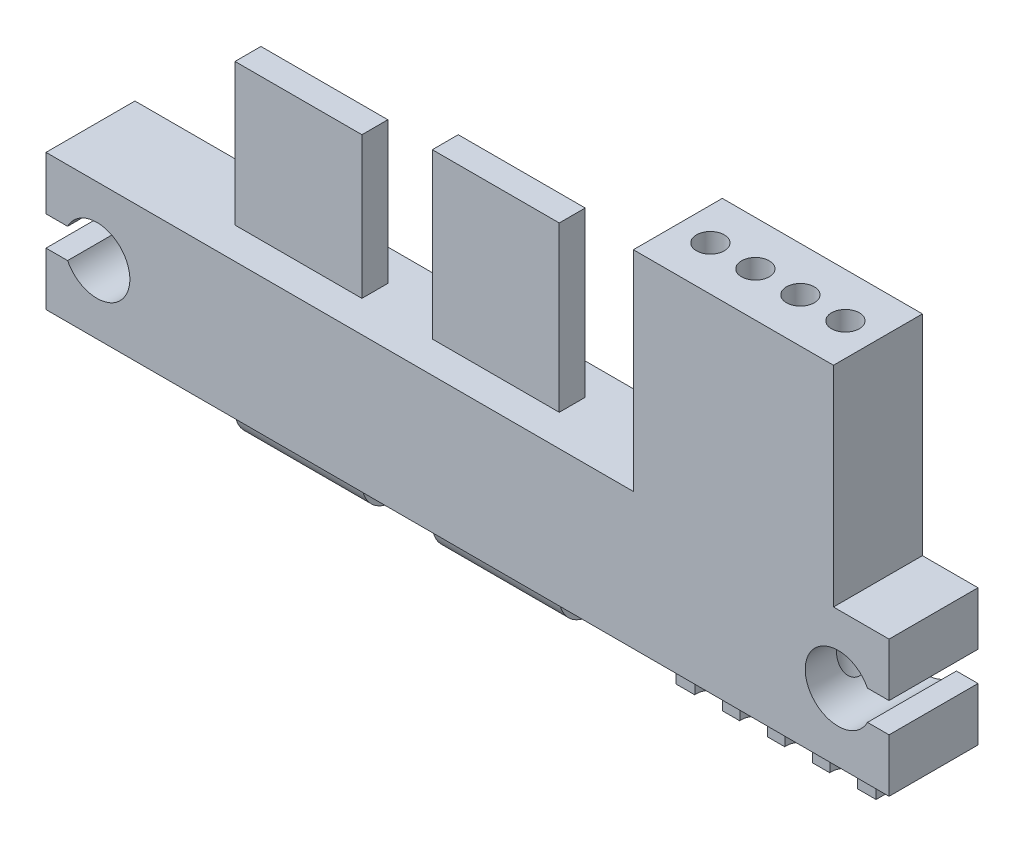
from build123d import *

# Parameters (mm, degrees)
EXTRUDE_1_DEPTH     = 2.4
SKETCH_2_W          = 6.85
SKETCH_2_H          = 1.4
EXTRUDE_2_DEPTH     = 7.65
SKETCH_3_W          = 6.85
SKETCH_3_H          = 1.4
EXTRUDE_3_DEPTH     = 1.2
SKETCH_5_W          = 6.85
SKETCH_5_H          = 1.4
SKETCH_6_W          = 1.2
SKETCH_6_H          = 2.5
EXTRUDE_4_DEPTH     = 2.8
CUT_EXTRUDE_1_DEPTH = 31.333891936
SKETCH_8_R          = 0.75
CUT_EXTRUDE_2_DEPTH = 32.800707539


with BuildPart() as part:
    # 草图1 → 凸台-拉伸1 (new, symmetric)
    with BuildSketch(Plane.XY):
        Polygon((-22.75, 7.35), (-22.75, 0), (22.75, 0), (22.75, 7.35), (19.75, 7.35), (19.75, 18.65), (8.95, 18.65), (8.95, 7.35), align=None)
    extrude(amount=EXTRUDE_1_DEPTH, both=True)

    # 草图2 → 凸台-拉伸2 (add)
    with BuildSketch(Plane(origin=(0, 7.35, 0), x_dir=(1, 0, 0), z_dir=(0, 1, 0))):
        with Locations((-10.825, 0)):
            Rectangle(SKETCH_2_W, SKETCH_2_H)
        with Locations((-0.175, 0)):
            Rectangle(SKETCH_2_W, SKETCH_2_H)
    extrude(amount=EXTRUDE_2_DEPTH)

    # 草图3 → 凸台-拉伸3 (add)
    with BuildSketch(Plane(origin=(0, 15, 0), x_dir=(1, 0, 0), z_dir=(0, 1, 0))):
        with Locations((-0.175, 0)):
            Rectangle(SKETCH_3_W, SKETCH_3_H)
    extrude(amount=EXTRUDE_3_DEPTH)

    # 扫描1: sweep along a path in 草图4
    with BuildLine(Plane(origin=(0, 0, 0), x_dir=(0, 0, -1), z_dir=(1, 0, 0))) as sweep_1_path:
        Line((0, 0), (0, -1.3))
        ThreePointArc((0, -1.3), (0.292893219, -2.007106781), (1, -2.3))
        Line((1, -2.3), (5, -2.3))
    # 草图5 → 扫描1 (sweep)
    with BuildSketch(Plane.XZ):
        with Locations((-0.175, 0)):
            Rectangle(SKETCH_5_W, SKETCH_5_H)
        with Locations((-10.825, 0)):
            Rectangle(SKETCH_5_W, SKETCH_5_H)
    sweep(path=sweep_1_path.line)

    # 草图6 → 凸台-拉伸4 (add)
    with BuildSketch(Plane.XZ):
        with Locations((16.75, -1.15)):
            Rectangle(SKETCH_6_W, SKETCH_6_H)
        with Locations((19.15, -1.15)):
            Rectangle(SKETCH_6_W, SKETCH_6_H)
        with Locations((14.35, -1.15)):
            Rectangle(SKETCH_6_W, SKETCH_6_H)
        with Locations((11.95, -1.15)):
            Rectangle(SKETCH_6_W, SKETCH_6_H)
        with Locations((9.55, -1.15)):
            Rectangle(SKETCH_6_W, SKETCH_6_H)
    extrude(amount=EXTRUDE_4_DEPTH)

    # 草图7 → 切除-拉伸1 (cut, through all)
    with BuildSketch(Plane.XY.offset(2.4)):
        with BuildLine():
            Line((-21.584495188, 4.475), (-22.75, 4.475))
            Line((-22.75, 4.475), (-22.75, 2.875))
            Line((-22.75, 2.875), (-21.584495188, 2.875))
            ThreePointArc((-21.584495188, 2.875), (-18.225, 3.675), (-21.584495188, 4.475))
        make_face()
        with BuildLine():
            Line((22.75, 2.875), (22.75, 4.475))
            Line((22.75, 4.475), (21.584495188, 4.475))
            ThreePointArc((21.584495188, 4.475), (18.225, 3.675), (21.584495188, 2.875))
            Line((21.584495188, 2.875), (22.75, 2.875))
        make_face()
    extrude(amount=-CUT_EXTRUDE_1_DEPTH, mode=Mode.SUBTRACT)

    # 草图8 → 切除-拉伸2 (cut, through all)
    with BuildSketch(Plane(origin=(0, 18.65, 0), x_dir=(1, 0, 0), z_dir=(0, 1, 0))):
        with Locations(Location((10.706638524, 0, 0), (0, 0, 270))):
            Circle(SKETCH_8_R)
        with Locations(Location((13.135546175, 0, 0), (0, 0, 270))):
            Circle(SKETCH_8_R)
        with Locations(Location((15.564453825, 0, 0), (0, 0, 270))):
            Circle(SKETCH_8_R)
        with Locations(Location((17.993361476, 0, 0), (0, 0, 270))):
            Circle(SKETCH_8_R)
    extrude(amount=-CUT_EXTRUDE_2_DEPTH, mode=Mode.SUBTRACT)


solid = part.part
